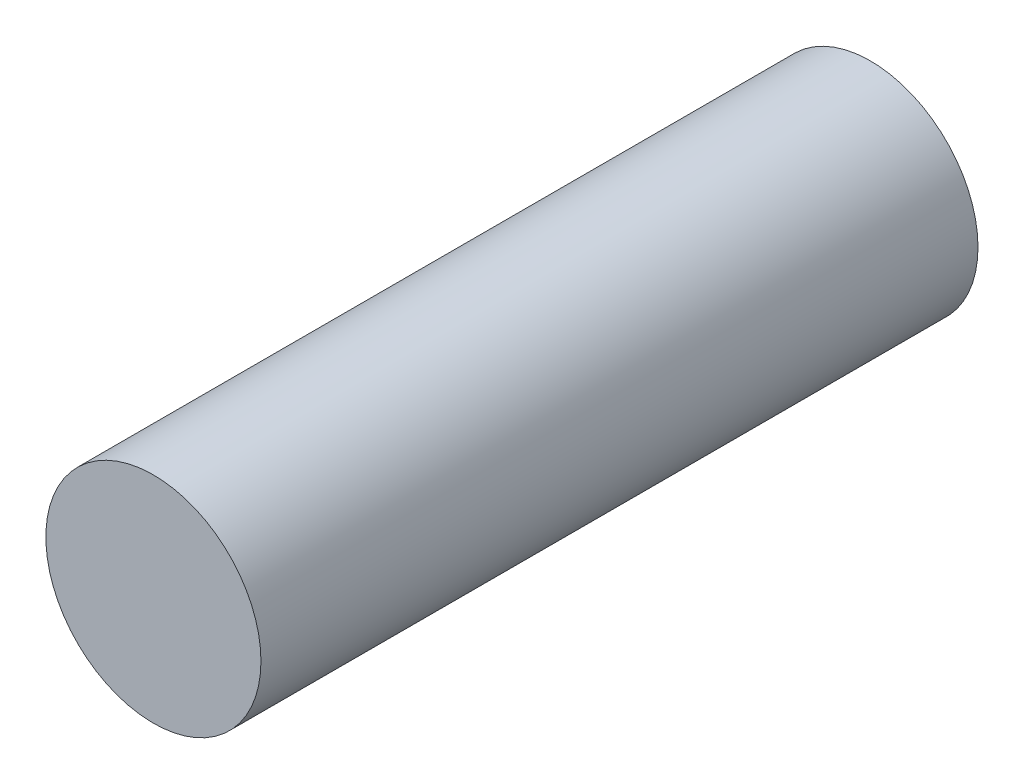
from build123d import *

# Parameters (mm, degrees)
ESBO_O1_R                = 2.25
RESSALTO_EXTRUS_O1_DEPTH = 15


with BuildPart() as part:
    # Esboço1 → Ressalto-extrusão1 (new body)
    with BuildSketch(Plane.XY):
        Circle(ESBO_O1_R)
    extrude(amount=RESSALTO_EXTRUS_O1_DEPTH)


solid = part.part
